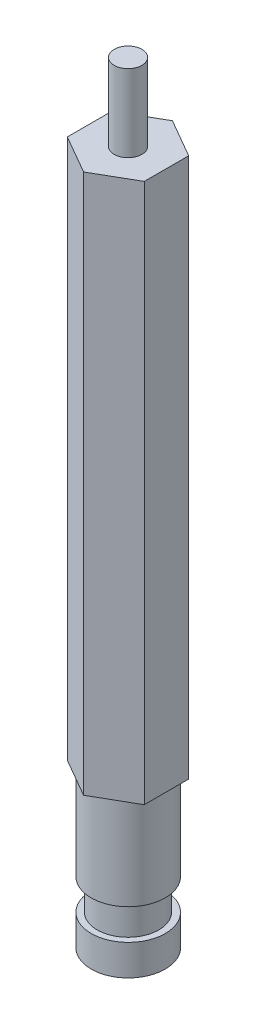
from build123d import *

# Parameters (mm, degrees)
BOSS_EXTRUDE1_DEPTH = 63.5
SKETCH2_OUTSIDE_W   = 21.185
SKETCH2_OUTSIDE_H   = 22.155
SKETCH2_OUTSIDE_R   = 1.143
CUT_EXTRUDE1_DEPTH  = 6.35
SKETCH3_OUTSIDE_W   = 21.185
SKETCH3_OUTSIDE_H   = 22.155
SKETCH3_OUTSIDE_R   = 3.048
CUT_EXTRUDE2_DEPTH  = 12.7
SKETCH4_OUTSIDE_W   = 21.185
SKETCH4_OUTSIDE_H   = 22.155
SKETCH4_OUTSIDE_R   = 2.54
CUT_EXTRUDE3_DEPTH  = 2.54


with BuildPart() as part:
    # Sketch1 → Boss-Extrude1 (new body)
    with BuildSketch(Plane(origin=(0, 0, 0), x_dir=(1, 0, 0), z_dir=(0, 1, 0))):
        Polygon((3.310191022, -4.420128359), (3.310191022, -0.762528359), (0.140765019, 1.063061018), (-3.028660983, -0.762528359), (-3.028660983, -4.420128359), (0.140765019, -6.245717737), align=None)
    extrude(amount=BOSS_EXTRUDE1_DEPTH)

    # Sketch2 outside → Cut-Extrude1 (cut)
    with BuildSketch(Plane(origin=(0, 63.5, 0), x_dir=(1, 0, 0), z_dir=(0, 1, 0))):
        with Locations((0.1405, -2.5915)):
            Rectangle(SKETCH2_OUTSIDE_W, SKETCH2_OUTSIDE_H)
        with Locations(Location((0.146339017, -2.591328359, 0), (0, 0, 270))):
            Circle(SKETCH2_OUTSIDE_R, mode=Mode.SUBTRACT)
    extrude(amount=-CUT_EXTRUDE1_DEPTH, mode=Mode.SUBTRACT)

    # Sketch3 outside → Cut-Extrude2 (cut)
    with BuildSketch(Plane.XZ):
        with Locations((0.1405, 2.5915)):
            Rectangle(SKETCH3_OUTSIDE_W, SKETCH3_OUTSIDE_H)
        with Locations(Location((0.152614949, 2.5845028, 0), (0, 0, 270))):
            Circle(SKETCH3_OUTSIDE_R, mode=Mode.SUBTRACT)
    extrude(amount=-CUT_EXTRUDE2_DEPTH, mode=Mode.SUBTRACT)

    # Sketch4 outside → Cut-Extrude3 (cut)
    with BuildSketch(Plane(origin=(0, 2.54, 0), x_dir=(-1, 0, 0), z_dir=(0, -1, 0))):
        with Locations((-0.1405, -2.5915)):
            Rectangle(SKETCH4_OUTSIDE_W, SKETCH4_OUTSIDE_H)
        with Locations(Location((-0.140765019, -2.591328359, 0), (0, 0, 90))):
            Circle(SKETCH4_OUTSIDE_R, mode=Mode.SUBTRACT)
    extrude(amount=-CUT_EXTRUDE3_DEPTH, mode=Mode.SUBTRACT)


solid = part.part
